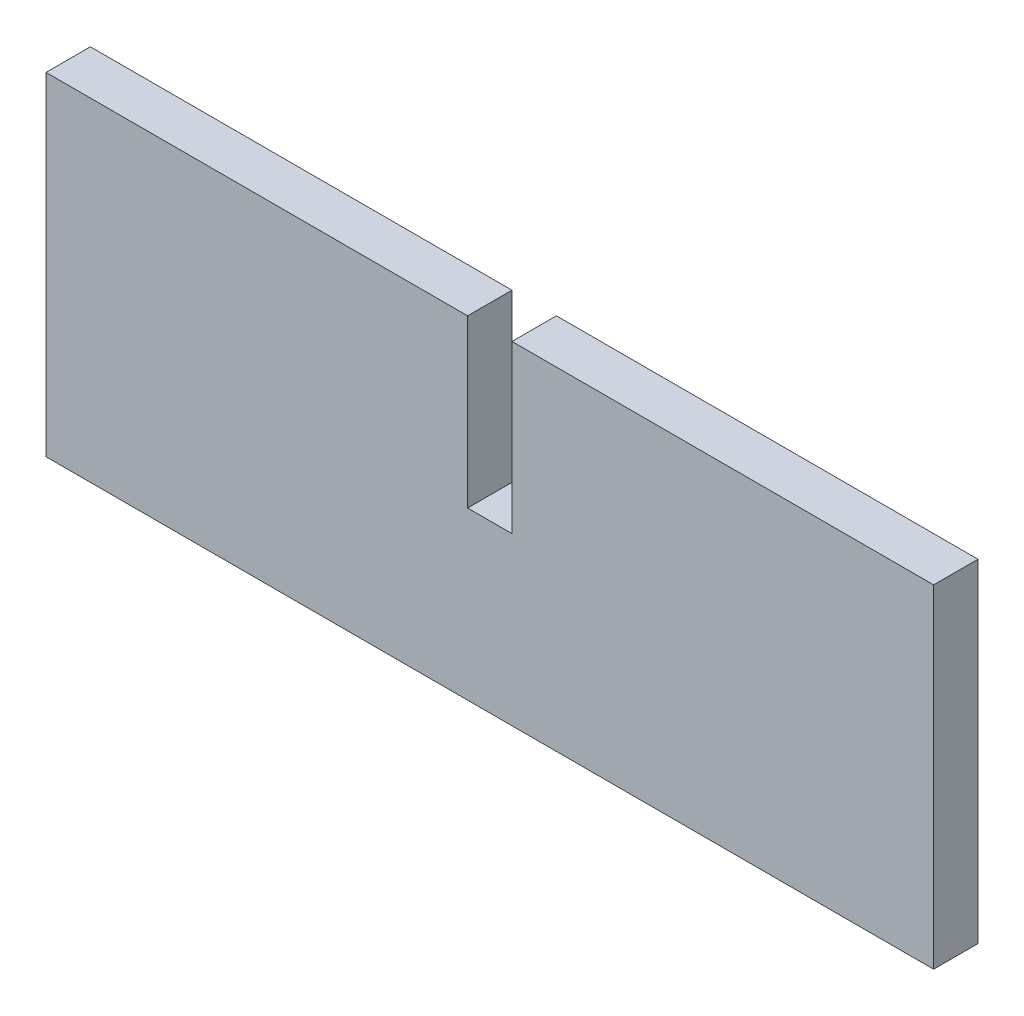
from build123d import *

# Parameters (mm, degrees)
BOSS_EXTRU_1_DEPTH = 8


with BuildPart() as part:
    # Esquisse1 → Boss.-Extru.1 (new body)
    with BuildSketch(Plane.XY):
        Polygon((-4, 60), (-80, 60), (-80, 0), (80, 0), (80, 60), (4, 60), (4, 30), (-4, 30), align=None)
    extrude(amount=BOSS_EXTRU_1_DEPTH)


solid = part.part
